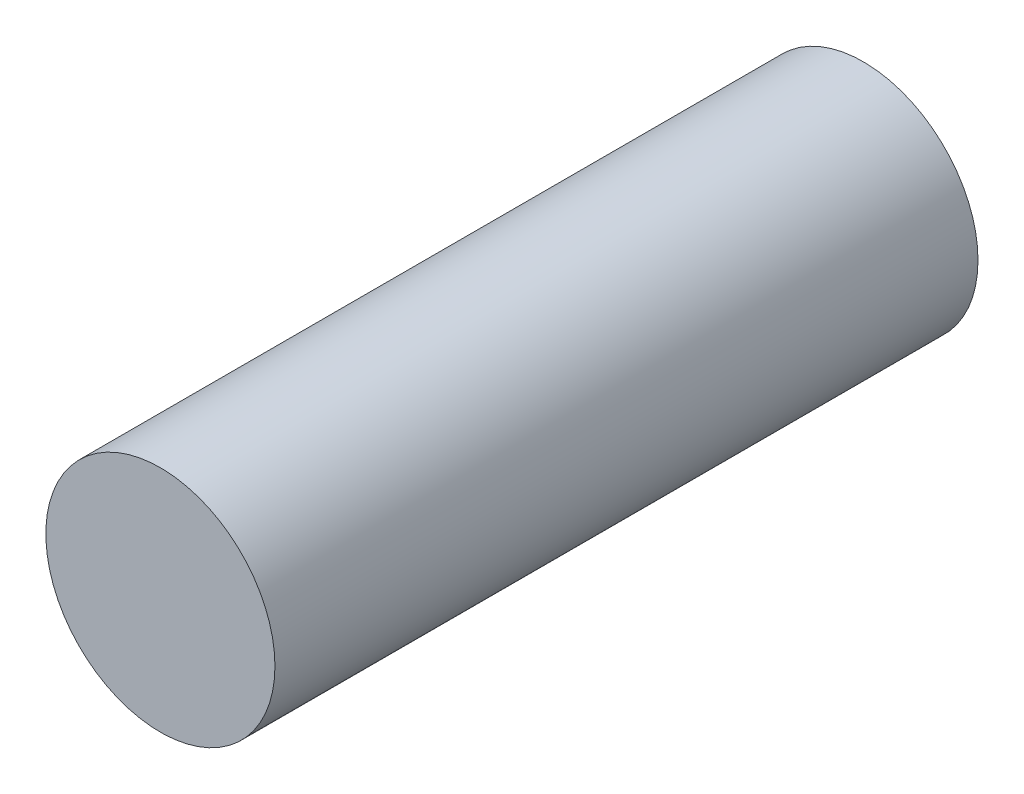
from build123d import *

# Parameters (mm, degrees)
SKETCH1_R           = 14.85
BOSS_EXTRUDE1_DEPTH = 91.14


with BuildPart() as part:
    # Sketch1 → Boss-Extrude1 (new body)
    with BuildSketch(Plane.XY):
        Circle(SKETCH1_R)
    extrude(amount=-BOSS_EXTRUDE1_DEPTH)


solid = part.part
